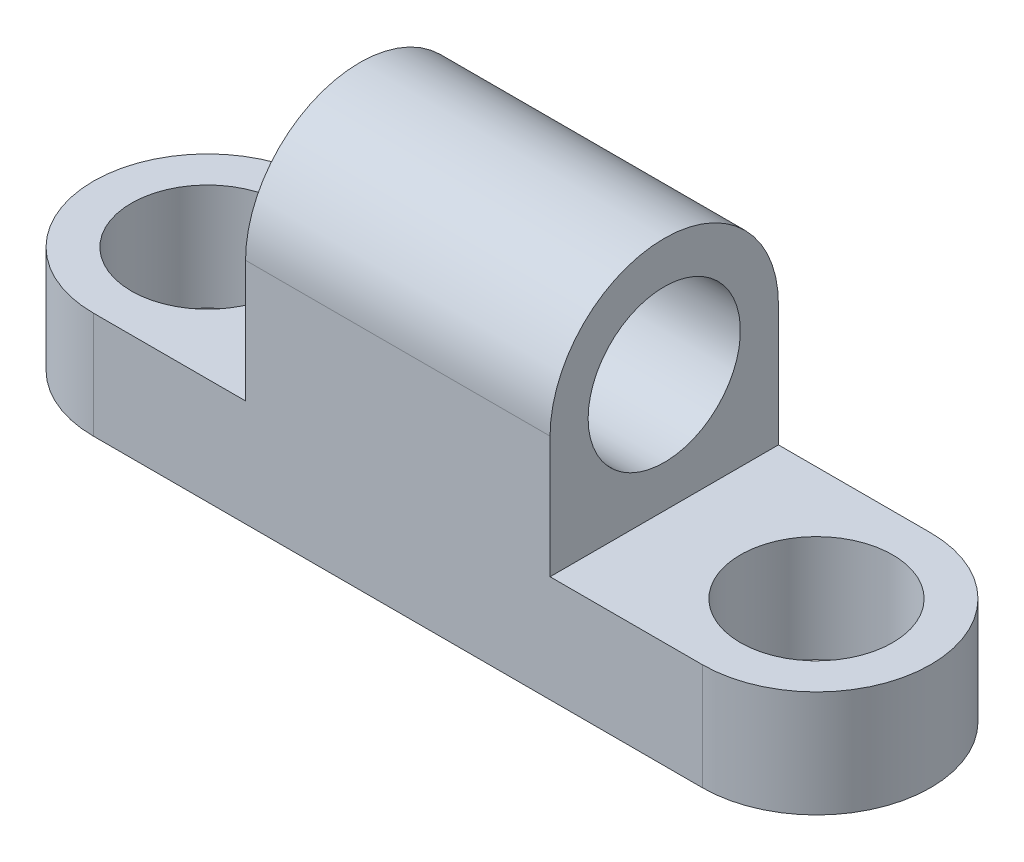
from build123d import *

# Parameters (mm, degrees)
SALIENTE_EXTRUIR1_DEPTH = 14
CROQUIS2_W              = 40
CROQUIS2_H              = 30
SALIENTE_EXTRUIR2_DEPTH = 16
CROQUIS3_R              = 15
SALIENTE_EXTRUIR4_DEPTH = 40
CROQUIS6_R              = 10
CORTAR_EXTRUIR1_DEPTH   = 96
CROQUIS8_R              = 10
CORTAR_EXTRUIR2_DEPTH   = 96
CROQUIS11_R             = 10
CORTAR_EXTRUIR3_DEPTH   = 96


with BuildPart() as part:
    # Croquis1 → Saliente-Extruir1 (new body)
    with BuildSketch(Plane(origin=(0, 0, 0), x_dir=(1, 0, 0), z_dir=(0, 1, 0))):
        with BuildLine():
            Line((0, 0), (80, 0))
            ThreePointArc((80, 0), (95, 15), (80, 30))
            Line((80, 30), (0, 30))
            ThreePointArc((0, 30), (-15, 15), (0, 0))
        make_face()
    extrude(amount=SALIENTE_EXTRUIR1_DEPTH)

    # Croquis2 → Saliente-Extruir2 (add)
    with BuildSketch(Plane(origin=(0, 14, 0), x_dir=(1, 0, 0), z_dir=(0, 1, 0))):
        with Locations((40, 15)):
            Rectangle(CROQUIS2_W, CROQUIS2_H)
    extrude(amount=SALIENTE_EXTRUIR2_DEPTH)

    # Croquis3 → Saliente-Extruir4 (add)
    with BuildSketch(Plane.ZY.offset(-20)):
        with Locations((-15, 30)):
            Circle(CROQUIS3_R)
    extrude(amount=-SALIENTE_EXTRUIR4_DEPTH)

    # Croquis6 → Cortar-Extruir1 (cut)
    with BuildSketch(Plane.ZY.offset(-20)):
        with Locations((-15, 29.5)):
            Circle(CROQUIS6_R)
    extrude(amount=-CORTAR_EXTRUIR1_DEPTH, mode=Mode.SUBTRACT)

    # Croquis8 → Cortar-Extruir2 (cut)
    with BuildSketch(Plane(origin=(0, 14, 0), x_dir=(1, 0, 0), z_dir=(0, 1, 0))):
        with Locations(Location((0, 15, 0), (0, 0, 270))):
            Circle(CROQUIS8_R)
    extrude(amount=-CORTAR_EXTRUIR2_DEPTH, mode=Mode.SUBTRACT)

    # Croquis11 → Cortar-Extruir3 (cut)
    with BuildSketch(Plane(origin=(0, 14, 0), x_dir=(1, 0, 0), z_dir=(0, 1, 0))):
        with Locations(Location((80, 15, 0), (0, 0, 270))):
            Circle(CROQUIS11_R)
    extrude(amount=-CORTAR_EXTRUIR3_DEPTH, mode=Mode.SUBTRACT)


solid = part.part
